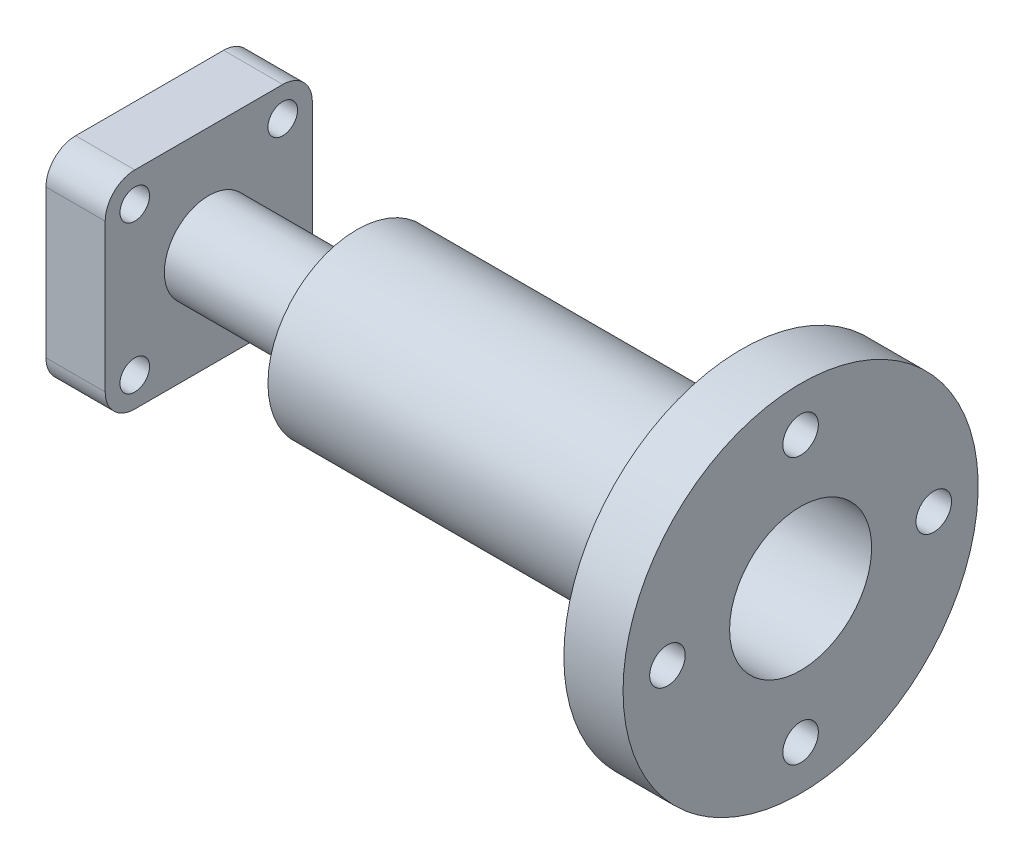
from build123d import *

# Parameters (mm, degrees)
SKETCH2_W              = 70
SKETCH2_H              = 70
SKETCH2_R              = 5
SKETCH2_R_2            = 9
BOSS_EXTRUDE1_DEPTH    = 20
FILLET1_R              = 10
F_12_0MM_DOWEL_HOLE1_D = 12


with BuildPart() as part:
    # Sketch1 → Revolve1 (revolve)
    with BuildSketch(Plane.XY, mode=Mode.PRIVATE) as revolve1_sk:
        Polygon((200, 24), (200, 60), (180, 60), (180, 30), (50, 30), (50, 15), (0, 15), (0, 9), (56, 9), (56, 24), align=None)
    revolve(revolve1_sk.sketch.rotate(Axis((0, 0, 0), (1, 0, 0)), 90), axis=Axis((0, 0, 0), (1, 0, 0)))

    # Sketch2 → Boss-Extrude1 (add)
    with BuildSketch(Plane.ZY):
        Rectangle(SKETCH2_W, SKETCH2_H)
        with Locations((-25, 25)):
            Circle(SKETCH2_R, mode=Mode.SUBTRACT)
        with Locations((25, 25)):
            Circle(SKETCH2_R, mode=Mode.SUBTRACT)
        with Locations(Location((25, -25, 0), (0, 0, 180))):
            Circle(SKETCH2_R, mode=Mode.SUBTRACT)
        with Locations(Location((-25, -25, 0), (0, 0, 180))):
            Circle(SKETCH2_R, mode=Mode.SUBTRACT)
        Circle(SKETCH2_R_2, mode=Mode.SUBTRACT)
    extrude(amount=BOSS_EXTRUDE1_DEPTH)

    # Fillet1
    fillet1_edges = [part.edges().sort_by_distance(p)[0] for p in [
        (-10, -35, 35),
        (-10, 35, 35),
        (-10, 35, -35),
        (-10, -35, -35),
    ]]
    fillet(fillet1_edges, radius=FILLET1_R)

    # Ø12.0mm Dowel Hole1 (through all)
    with Locations(Plane(origin=(200, 0, 0), x_dir=(0, 0, -1), z_dir=(1, 0, 0))):
        with Locations((45, 0), (0, 45), (-45, 0), (0, -45)):
            Hole(F_12_0MM_DOWEL_HOLE1_D / 2)


solid = part.part
